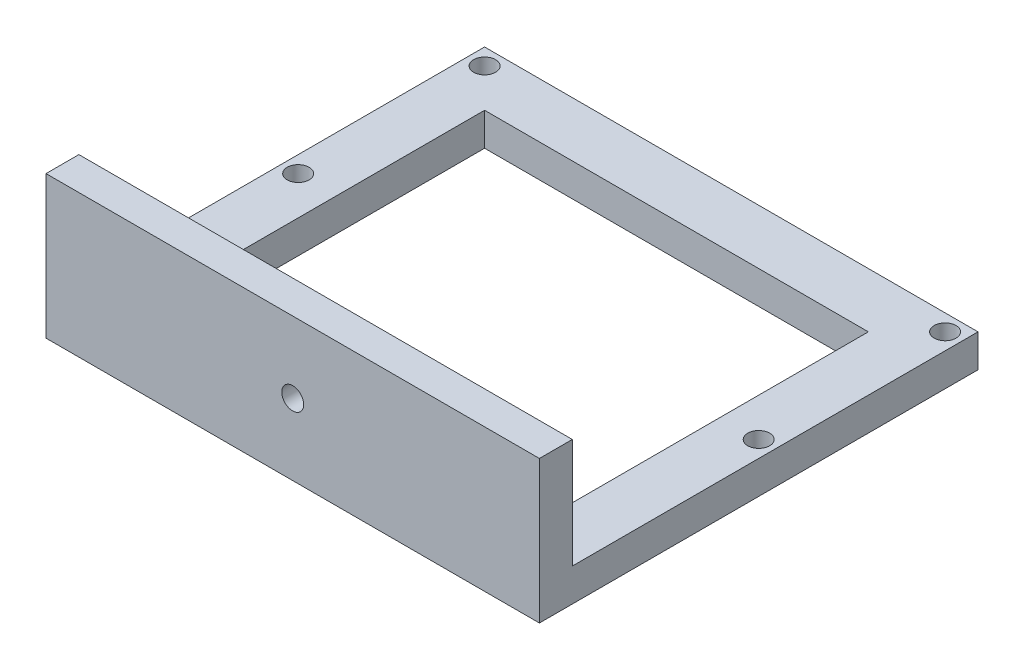
from build123d import *

# Parameters (mm, degrees)
SKETCH2_W                 = 5
SKETCH2_H                 = 40
SKETCH2_W_2               = 35
SKETCH2_H_2               = 5
BOSS_EXTRUDE1_DEPTH       = 3
F_2_0MM_DOWEL_HOLE1_D     = 2
F_2_0MM_DOWEL_HOLE1_DEPTH = 12.029
F_2_0MM_DOWEL_HOLE1_TIP   = 0.600860619
SKETCH4_W                 = 45
SKETCH4_H                 = 3
BOSS_EXTRUDE2_DEPTH       = 10
F_2_0MM_DOWEL_HOLE2_D     = 2
F_2_0MM_DOWEL_HOLE2_DEPTH = 12
F_2_0MM_DOWEL_HOLE2_TIP   = 0.600860619


with BuildPart() as part:
    # Sketch2 → Boss-Extrude1 (new body)
    with BuildSketch(Plane(origin=(0, 0, 0), x_dir=(1, 0, 0), z_dir=(0, 1, 0))):
        with Locations((-42.5, 20)):
            Rectangle(SKETCH2_W, SKETCH2_H)
        with Locations((-22.5, 37.5)):
            Rectangle(SKETCH2_W_2, SKETCH2_H_2)
        with Locations((-2.5, 20)):
            Rectangle(SKETCH2_W, SKETCH2_H)
        with Locations((-22.5, 2.5)):
            Rectangle(SKETCH2_W_2, SKETCH2_H_2)
    extrude(amount=BOSS_EXTRUDE1_DEPTH)

    # Ø2.0mm Dowel Hole1
    with Locations(Plane(origin=(-1.5, 0, -38.5), x_dir=(0, 0, -1), z_dir=(0, -1, 0))):
        with Locations((0, 0), (0, -42), (-17, 0), (-17, -42)):
            Hole(F_2_0MM_DOWEL_HOLE1_D / 2, depth=F_2_0MM_DOWEL_HOLE1_DEPTH)
            with Locations((0, 0, -(F_2_0MM_DOWEL_HOLE1_DEPTH + F_2_0MM_DOWEL_HOLE1_TIP / 2))):  # 118° drill point
                Cone(0, F_2_0MM_DOWEL_HOLE1_D / 2, F_2_0MM_DOWEL_HOLE1_TIP, mode=Mode.SUBTRACT)

    # Sketch4 → Boss-Extrude2 (add)
    with BuildSketch(Plane(origin=(0, 3, 0), x_dir=(1, 0, 0), z_dir=(0, 1, 0))):
        with Locations((-22.5, 1.5)):
            Rectangle(SKETCH4_W, SKETCH4_H)
    extrude(amount=BOSS_EXTRUDE2_DEPTH)

    # Ø2.0mm Dowel Hole2
    with Locations(Plane(origin=(0, 0, -3), x_dir=(-1, 0, 0), z_dir=(0, 0, -1))):
        with Locations((22.5, 6.5)):
            Hole(F_2_0MM_DOWEL_HOLE2_D / 2, depth=F_2_0MM_DOWEL_HOLE2_DEPTH)
            with Locations((0, 0, -(F_2_0MM_DOWEL_HOLE2_DEPTH + F_2_0MM_DOWEL_HOLE2_TIP / 2))):  # 118° drill point
                Cone(0, F_2_0MM_DOWEL_HOLE2_D / 2, F_2_0MM_DOWEL_HOLE2_TIP, mode=Mode.SUBTRACT)


solid = part.part
